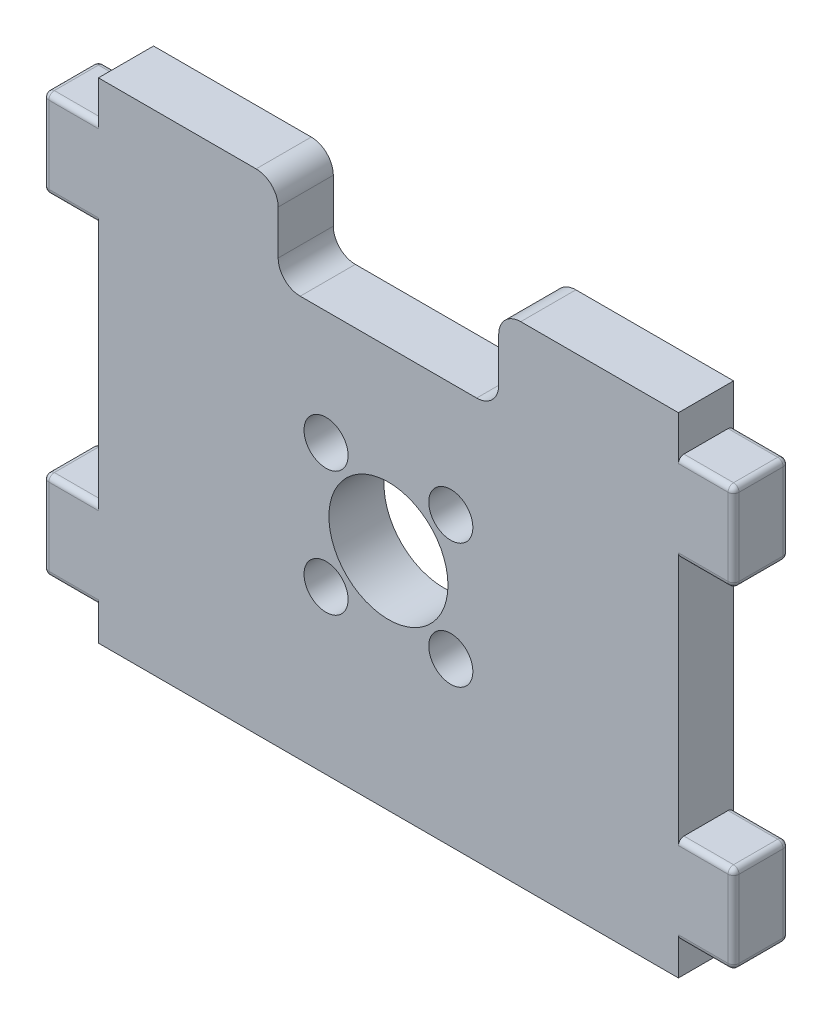
from build123d import *

# Parameters (mm, degrees)
CROQUIS1_W               = 52.6
CROQUIS1_H               = 45
CROQUIS1_R               = 5.4
CROQUIS1_R_2             = 2
SALIENTE_EXTRUIR1_DEPTH  = 5
CROQUIS2_W               = 5
CROQUIS2_H               = 8
SALIENTE_EXTRUIR2_DEPTH  = 5
REDONDEO1_R              = 0.5
REDONDEO1_OF_SIMETR_A1_R = 0.5
CROQUIS3_W               = 20
CROQUIS3_H               = 8
CORTAR_EXTRUIR1_DEPTH    = 5
REDONDEO2_R              = 2
CROQUIS4_W               = 52.6
CROQUIS4_H               = 0.6
CORTAR_EXTRUIR2_DEPTH    = 5


with BuildPart() as part:
    # Croquis1 → Saliente-Extruir1 (new body)
    with BuildSketch(Plane.XY):
        Rectangle(CROQUIS1_W, CROQUIS1_H)
        with Locations((0, -1.5)):
            Circle(CROQUIS1_R, mode=Mode.SUBTRACT)
        with Locations((-5.656854249, 4.156854249)):
            Circle(CROQUIS1_R_2, mode=Mode.SUBTRACT)
        with Locations((5.656854249, 4.156854249)):
            Circle(CROQUIS1_R_2, mode=Mode.SUBTRACT)
        with Locations((5.656854249, -7.156854249)):
            Circle(CROQUIS1_R_2, mode=Mode.SUBTRACT)
        with Locations((-5.656854249, -7.156854249)):
            Circle(CROQUIS1_R_2, mode=Mode.SUBTRACT)
    extrude(amount=SALIENTE_EXTRUIR1_DEPTH)

    # Croquis2 → Saliente-Extruir2 (add)
    with BuildSketch(Plane.ZY.offset(26.3)):
        with Locations((2.5, 15)):
            Rectangle(CROQUIS2_W, CROQUIS2_H)
        with Locations((2.5, -15)):
            Rectangle(CROQUIS2_W, CROQUIS2_H)
    saliente_extruir2 = extrude(amount=SALIENTE_EXTRUIR2_DEPTH)

    # Redondeo1
    redondeo1_edges = [part.edges().sort_by_distance(p)[0] for p in [
        (-28.8, 19, 0),
        (-28.8, 11, 0),
        (-28.8, 11, 5),
        (-28.8, 19, 5),
        (-31.3, 15, 0),
        (-31.3, 11, 2.5),
        (-31.3, 15, 5),
        (-31.3, 19, 2.5),
        (-28.8, -19, 0),
        (-28.8, -19, 5),
        (-28.8, -11, 5),
        (-28.8, -11, 0),
        (-31.3, -19, 2.5),
        (-31.3, -15, 5),
        (-31.3, -11, 2.5),
        (-31.3, -15, 0),
    ]]
    fillet(redondeo1_edges, radius=REDONDEO1_R)

    # Simetría1: Saliente-Extruir2 across plane
    add(saliente_extruir2.mirror(Plane(origin=(0, 0, 0), x_dir=(0, 0, 1), z_dir=(1, 0, 0))))

    # Redondeo1 of Simetría1
    redondeo1_of_simetr_a1_edges = [part.edges().sort_by_distance(p)[0] for p in [
        (28.8, 19, 0),
        (28.8, 11, 0),
        (28.8, 11, 5),
        (28.8, 19, 5),
        (31.3, 15, 0),
        (31.3, 11, 2.5),
        (31.3, 15, 5),
        (31.3, 19, 2.5),
        (28.8, -19, 0),
        (28.8, -19, 5),
        (28.8, -11, 5),
        (28.8, -11, 0),
        (31.3, -19, 2.5),
        (31.3, -15, 5),
        (31.3, -11, 2.5),
        (31.3, -15, 0),
    ]]
    fillet(redondeo1_of_simetr_a1_edges, radius=REDONDEO1_OF_SIMETR_A1_R)

    # Croquis3 → Cortar-Extruir1 (cut)
    with BuildSketch(Plane.XY.offset(5)):
        with Locations((0, 18.5)):
            Rectangle(CROQUIS3_W, CROQUIS3_H)
    extrude(amount=-CORTAR_EXTRUIR1_DEPTH, mode=Mode.SUBTRACT)

    # Redondeo2
    redondeo2_edges = [part.edges().sort_by_distance(p)[0] for p in [
        (-10, 14.5, 2.5),
        (-10, 22.5, 2.5),
        (10, 22.5, 2.5),
        (10, 14.5, 2.5),
    ]]
    fillet(redondeo2_edges, radius=REDONDEO2_R)

    # Croquis4 → Cortar-Extruir2 (cut)
    with BuildSketch(Plane.XY.offset(5)):
        with Locations((0, -22.2)):
            Rectangle(CROQUIS4_W, CROQUIS4_H)
    extrude(amount=-CORTAR_EXTRUIR2_DEPTH, mode=Mode.SUBTRACT)


solid = part.part
